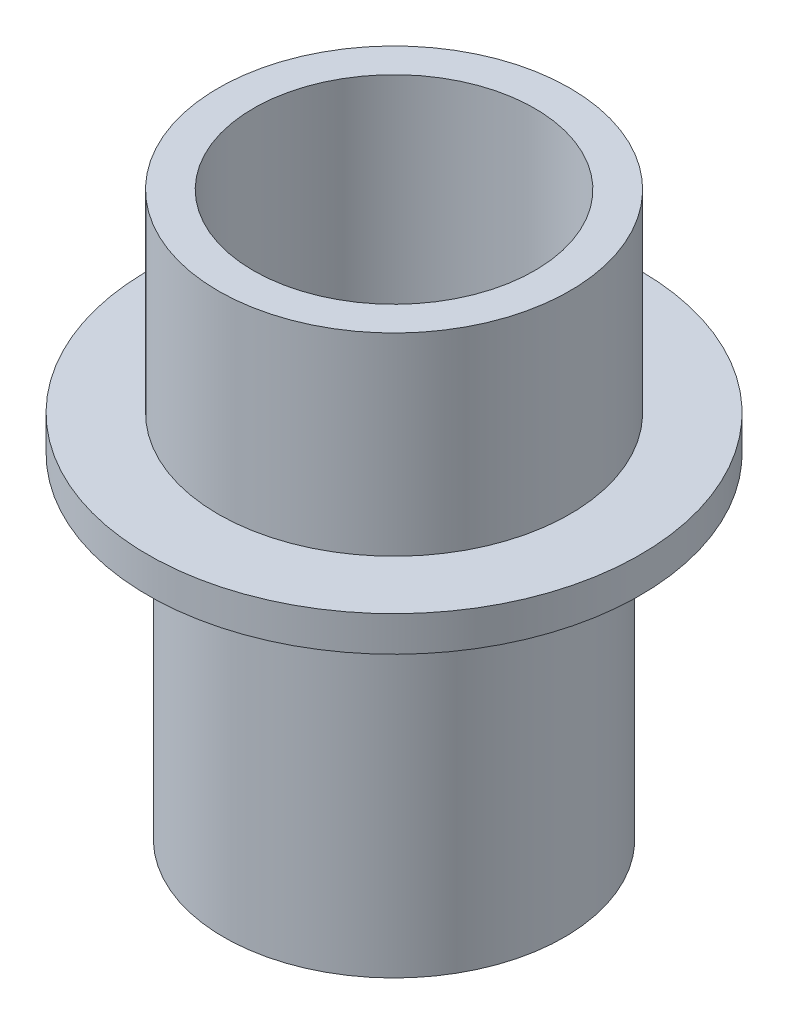
from build123d import *

# Parameters (mm, degrees)
SKETCH1_R             = 22.225
BOSS_EXTRUDE1_DEPTH   = 50.8
SKETCH2_R             = 22.225
SKETCH2_R_2           = 15.375
CUT_EXTRUDE1_DEPTH    = 30.1625
SKETCH3_R             = 12.7
CUT_EXTRUDE2_DEPTH    = 49.2125
CUT_EXTRUDE3_START    = -17.4625
SKETCH5_R             = 22.225
SKETCH5_R_2           = 15.875
CUT_EXTRUDE3_DEPTH    = 17.4625
SKETCH6_R             = 8.001
SKETCH6_R_2           = 1.70053
MOTORINTERFACFE_DEPTH = 60.737268518


with BuildPart() as part:
    # Sketch1 → Boss-Extrude1 (new body)
    with BuildSketch(Plane(origin=(0, 0, 0), x_dir=(1, 0, 0), z_dir=(0, 1, 0))):
        with Locations(Location((0, 0, 0), (0, 0, 270))):
            Circle(SKETCH1_R)
    extrude(amount=BOSS_EXTRUDE1_DEPTH)

    # Sketch2 → Cut-Extrude1 (cut)
    with BuildSketch(Plane.XZ):
        with Locations(Location((0, 0, 0), (0, 0, 270))):
            Circle(SKETCH2_R)
        with Locations(Location((0, 0, 0), (0, 0, 270))):
            Circle(SKETCH2_R_2, mode=Mode.SUBTRACT)
    extrude(amount=-CUT_EXTRUDE1_DEPTH, mode=Mode.SUBTRACT)

    # Sketch3 → Cut-Extrude2 (cut)
    with BuildSketch(Plane(origin=(0, 50.8, 0), x_dir=(1, 0, 0), z_dir=(0, 1, 0))):
        with Locations(Location((0, 0, 0), (0, 0, 270))):
            Circle(SKETCH3_R)
    extrude(amount=-CUT_EXTRUDE2_DEPTH, mode=Mode.SUBTRACT)

    # Sketch5 → Cut-Extrude3 (cut)
    with BuildSketch(Plane(origin=(0, 50.8, 0), x_dir=(1, 0, 0), z_dir=(0, 1, 0)).offset(CUT_EXTRUDE3_START)):
        with Locations(Location((0, 0, 0), (0, 0, 90))):
            Circle(SKETCH5_R)
        with Locations(Location((0, 0, 0), (0, 0, 270))):
            Circle(SKETCH5_R_2, mode=Mode.SUBTRACT)
    extrude(amount=CUT_EXTRUDE3_DEPTH, mode=Mode.SUBTRACT)

    # Sketch6 → MotorInterfacfe (cut, through all)
    with BuildSketch(Plane.XZ):
        with Locations(Location((0, 0, 0), (0, 0, 270))):
            Circle(SKETCH6_R)
        with Locations(Location((-7.07105367, 7.07105367, 0), (0, 0, 270))):
            Circle(SKETCH6_R_2)
        with Locations(Location((-7.162899066, -6.970031681, 0), (0, 0, 270))):
            Circle(SKETCH6_R_2)
        with Locations(Location((7.158557907, -7.103864696, 0), (0, 0, 270))):
            Circle(SKETCH6_R_2)
        with Locations(Location((7.036006619, 7.187404798, 0), (0, 0, 270))):
            Circle(SKETCH6_R_2)
    extrude(amount=-MOTORINTERFACFE_DEPTH, mode=Mode.SUBTRACT)


solid = part.part
